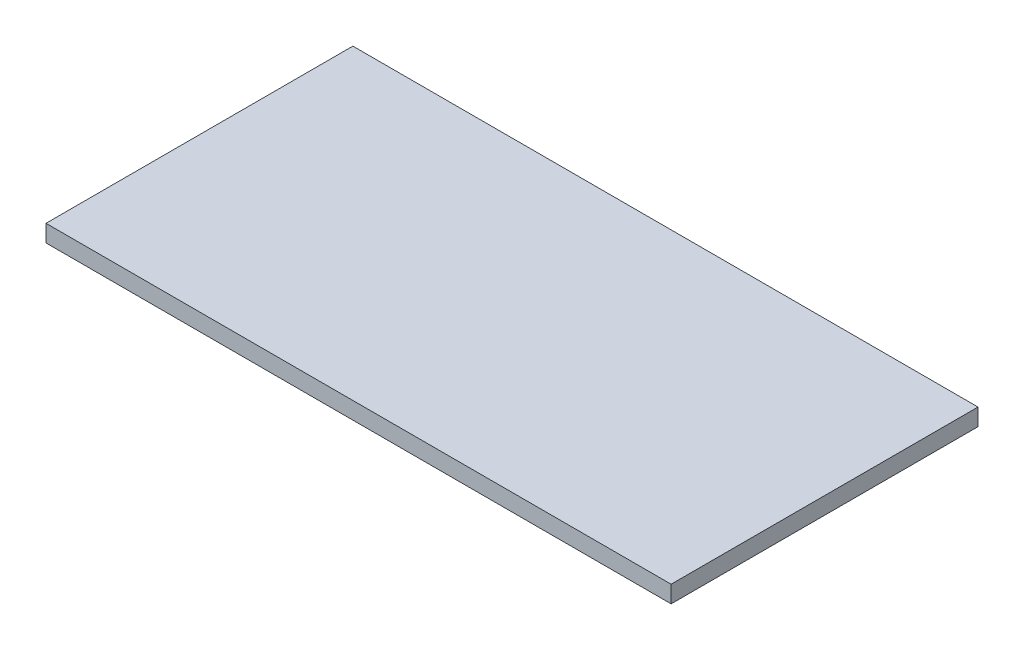
from build123d import *

# Parameters (mm, degrees)
ESQUISSE1_W        = 110
ESQUISSE1_H        = 54
BOSS_EXTRU_1_DEPTH = 3


with BuildPart() as part:
    # Esquisse1 → Boss.-Extru.1 (new body)
    with BuildSketch(Plane(origin=(0, 0, 0), x_dir=(1, 0, 0), z_dir=(0, 1, 0))):
        with Locations((1, 8.02173913)):
            Rectangle(ESQUISSE1_W, ESQUISSE1_H)
    extrude(amount=BOSS_EXTRU_1_DEPTH)


solid = part.part
